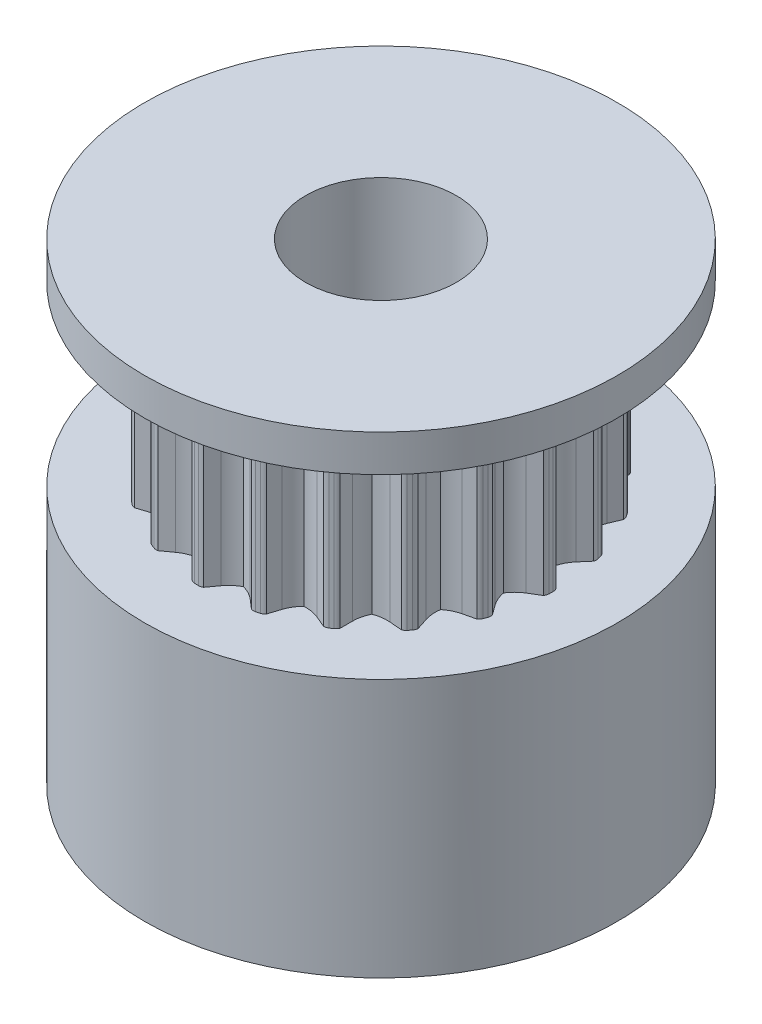
from build123d import *

# Parameters (mm, degrees)
EXTRUDE_1_DEPTH     = 3
SKETCH_3_R          = 8
EXTRUDE_2_DEPTH     = 1.25
SKETCH_4_R          = 2.55
CUT_EXTRUDE_1_DEPTH = 15.150971698
SKETCH_6_W          = 5.5
SKETCH_6_H          = 7.5


with BuildPart() as part:
    # 草图1 → 凸台-拉伸1 (new, symmetric)
    with BuildSketch(Plane(origin=(0, 0, 0), x_dir=(1, 0, 0), z_dir=(0, 1, 0))):
        with BuildLine():
            Line((-3.376752543, 4.959590937), (-3.267426565, 5.032288112))
            ThreePointArc((-3.267426565, 5.032288112), (-3.200992642, 5.061911558), (-3.128917634, 5.071720118))
            Line((-3.128917634, 5.071720118), (-2.741254989, 4.909115673))
            ThreePointArc((-2.741254989, 4.909115673), (-2.480001123, 4.833197231), (-2.208338066, 4.818487533))
            ThreePointArc((-2.208338066, 4.818487533), (-2.042130114, 5.033875807), (-1.929083368, 5.281338179))
            Line((-1.929083368, 5.281338179), (-1.799177632, 5.681146923))
            ThreePointArc((-1.799177632, 5.681146923), (-1.744694694, 5.729340533), (-1.678884625, 5.7603252))
            Line((-1.678884625, 5.7603252), (-1.552444779, 5.795680737))
            ThreePointArc((-1.552444779, 5.795680737), (-1.480108215, 5.803325098), (-1.408529797, 5.79038119))
            Line((-1.408529797, 5.79038119), (-1.09008825, 5.515940827))
            ThreePointArc((-1.09008825, 5.515940827), (-0.865081147, 5.363006214), (-0.611259773, 5.265067959))
            ThreePointArc((-0.611259773, 5.265067959), (-0.38662798, 5.418553299), (-0.202644057, 5.618970634))
            Line((-0.202644057, 5.618970634), (0.044451336, 5.959068265))
            ThreePointArc((0.044451336, 5.959068265), (0.111160334, 5.988066959), (0.183324217, 5.997198699))
            Line((0.183324217, 5.997198699), (0.314501119, 5.991751751))
            ThreePointArc((0.314501119, 5.991751751), (0.385659516, 5.976668742), (0.449734749, 5.942239407))
            Line((0.449734749, 5.942239407), (0.667783922, 5.582827262))
            ThreePointArc((0.667783922, 5.582827262), (0.834518999, 5.367846783), (1.045652886, 5.196266848))
            ThreePointArc((1.045652886, 5.196266848), (1.306719995, 5.27282504), (1.543631466, 5.406579094))
            Line((1.543631466, 5.406579094), (1.883729097, 5.653674487))
            ThreePointArc((1.883729097, 5.653674487), (1.956134214, 5.660639669), (2.027588008, 5.647024603))
            Line((2.027588008, 5.647024603), (2.150661455, 5.601308356))
            ThreePointArc((2.150661455, 5.601308356), (2.213676207, 5.564974409), (2.263976125, 5.512429829))
            Line((2.263976125, 5.512429829), (2.360288751, 5.103227666))
            ThreePointArc((2.360288751, 5.103227666), (2.452430611, 4.847245108), (2.600209754, 4.618818935))
            ThreePointArc((2.600209754, 4.618818935), (2.872157112, 4.610955928), (3.138805586, 4.664953922))
            Line((3.138805586, 4.664953922), (3.53861433, 4.794859658))
            ThreePointArc((3.53861433, 4.794859658), (3.609628047, 4.779109528), (3.673377357, 4.744080395))
            Line((3.673377357, 4.744080395), (3.776300064, 4.662569873))
            ThreePointArc((3.776300064, 4.662569873), (3.825002847, 4.608541606), (3.856603744, 4.543025212))
            Line((3.856603744, 4.543025212), (3.821752072, 4.12408859))
            ThreePointArc((3.821752072, 4.12408859), (3.830281228, 3.85216131), (3.900239975, 3.589248842))
            ThreePointArc((3.900239975, 3.589248842), (4.156447479, 3.497734324), (4.426731546, 3.466690558))
            Line((4.426731546, 3.466690558), (4.847115337, 3.466690558))
            ThreePointArc((4.847115337, 3.466690558), (4.909786338, 3.429766849), (4.959590937, 3.376752543))
            Line((4.959590937, 3.376752543), (5.032288112, 3.267426565))
            ThreePointArc((5.032288112, 3.267426565), (5.061911558, 3.200992642), (5.071720118, 3.128917634))
            Line((5.071720118, 3.128917634), (4.909115673, 2.741254989))
            ThreePointArc((4.909115673, 2.741254989), (4.833197231, 2.480001123), (4.818487533, 2.208338066))
            ThreePointArc((4.818487533, 2.208338066), (5.033875807, 2.042130114), (5.281338179, 1.929083368))
            Line((5.281338179, 1.929083368), (5.681146923, 1.799177632))
            ThreePointArc((5.681146923, 1.799177632), (5.729340533, 1.744694694), (5.7603252, 1.678884625))
            Line((5.7603252, 1.678884625), (5.795680737, 1.552444779))
            ThreePointArc((5.795680737, 1.552444779), (5.803325098, 1.480108215), (5.79038119, 1.408529797))
            Line((5.79038119, 1.408529797), (5.515940827, 1.09008825))
            ThreePointArc((5.515940827, 1.09008825), (5.363006214, 0.865081147), (5.265067959, 0.611259773))
            ThreePointArc((5.265067959, 0.611259773), (5.418553299, 0.38662798), (5.618970634, 0.202644057))
            Line((5.618970634, 0.202644057), (5.959068265, -0.044451336))
            ThreePointArc((5.959068265, -0.044451336), (5.988066959, -0.111160334), (5.997198699, -0.183324217))
            Line((5.997198699, -0.183324217), (5.991751751, -0.314501119))
            ThreePointArc((5.991751751, -0.314501119), (5.976668742, -0.385659516), (5.942239407, -0.449734749))
            Line((5.942239407, -0.449734749), (5.582827262, -0.667783922))
            ThreePointArc((5.582827262, -0.667783922), (5.367846783, -0.834518999), (5.196266848, -1.045652886))
            ThreePointArc((5.196266848, -1.045652886), (5.27282504, -1.306719995), (5.406579094, -1.543631466))
            Line((5.406579094, -1.543631466), (5.653674487, -1.883729097))
            ThreePointArc((5.653674487, -1.883729097), (5.660639669, -1.956134214), (5.647024603, -2.027588008))
            Line((5.647024603, -2.027588008), (5.601308356, -2.150661455))
            ThreePointArc((5.601308356, -2.150661455), (5.564974409, -2.213676207), (5.512429829, -2.263976125))
            Line((5.512429829, -2.263976125), (5.103227666, -2.360288751))
            ThreePointArc((5.103227666, -2.360288751), (4.847245108, -2.452430611), (4.618818935, -2.600209754))
            ThreePointArc((4.618818935, -2.600209754), (4.610955928, -2.872157112), (4.664953922, -3.138805586))
            Line((4.664953922, -3.138805586), (4.794859658, -3.53861433))
            ThreePointArc((4.794859658, -3.53861433), (4.779109528, -3.609628047), (4.744080395, -3.673377357))
            Line((4.744080395, -3.673377357), (4.662569873, -3.776300064))
            ThreePointArc((4.662569873, -3.776300064), (4.608541606, -3.825002847), (4.543025212, -3.856603744))
            Line((4.543025212, -3.856603744), (4.12408859, -3.821752072))
            ThreePointArc((4.12408859, -3.821752072), (3.85216131, -3.830281228), (3.589248842, -3.900239975))
            ThreePointArc((3.589248842, -3.900239975), (3.497734324, -4.156447479), (3.466690558, -4.426731546))
            Line((3.466690558, -4.426731546), (3.466690558, -4.847115337))
            ThreePointArc((3.466690558, -4.847115337), (3.429766849, -4.909786338), (3.376752543, -4.959590937))
            Line((3.376752543, -4.959590937), (3.267426565, -5.032288112))
            ThreePointArc((3.267426565, -5.032288112), (3.200992642, -5.061911558), (3.128917634, -5.071720118))
            Line((3.128917634, -5.071720118), (2.741254989, -4.909115673))
            ThreePointArc((2.741254989, -4.909115673), (2.480001123, -4.833197231), (2.208338066, -4.818487533))
            ThreePointArc((2.208338066, -4.818487533), (2.042130114, -5.033875807), (1.929083368, -5.281338179))
            Line((1.929083368, -5.281338179), (1.799177632, -5.681146923))
            ThreePointArc((1.799177632, -5.681146923), (1.744694694, -5.729340533), (1.678884625, -5.7603252))
            Line((1.678884625, -5.7603252), (1.552444779, -5.795680737))
            ThreePointArc((1.552444779, -5.795680737), (1.480108215, -5.803325098), (1.408529797, -5.79038119))
            Line((1.408529797, -5.79038119), (1.09008825, -5.515940827))
            ThreePointArc((1.09008825, -5.515940827), (0.865081147, -5.363006214), (0.611259773, -5.265067959))
            ThreePointArc((0.611259773, -5.265067959), (0.38662798, -5.418553299), (0.202644057, -5.618970634))
            Line((0.202644057, -5.618970634), (-0.044451336, -5.959068265))
            ThreePointArc((-0.044451336, -5.959068265), (-0.111160334, -5.988066959), (-0.183324217, -5.997198699))
            Line((-0.183324217, -5.997198699), (-0.314501119, -5.991751751))
            ThreePointArc((-0.314501119, -5.991751751), (-0.385659516, -5.976668742), (-0.449734749, -5.942239407))
            Line((-0.449734749, -5.942239407), (-0.667783922, -5.582827262))
            ThreePointArc((-0.667783922, -5.582827262), (-0.834518999, -5.367846783), (-1.045652886, -5.196266848))
            ThreePointArc((-1.045652886, -5.196266848), (-1.306719995, -5.27282504), (-1.543631466, -5.406579094))
            Line((-1.543631466, -5.406579094), (-1.883729097, -5.653674487))
            ThreePointArc((-1.883729097, -5.653674487), (-1.956134214, -5.660639669), (-2.027588008, -5.647024603))
            Line((-2.027588008, -5.647024603), (-2.150661455, -5.601308356))
            ThreePointArc((-2.150661455, -5.601308356), (-2.213676207, -5.564974409), (-2.263976125, -5.512429829))
            Line((-2.263976125, -5.512429829), (-2.360288751, -5.103227666))
            ThreePointArc((-2.360288751, -5.103227666), (-2.452430611, -4.847245108), (-2.600209754, -4.618818935))
            ThreePointArc((-2.600209754, -4.618818935), (-2.872157112, -4.610955928), (-3.138805586, -4.664953922))
            Line((-3.138805586, -4.664953922), (-3.53861433, -4.794859658))
            ThreePointArc((-3.53861433, -4.794859658), (-3.609628047, -4.779109528), (-3.673377357, -4.744080395))
            Line((-3.673377357, -4.744080395), (-3.776300064, -4.662569873))
            ThreePointArc((-3.776300064, -4.662569873), (-3.825002847, -4.608541606), (-3.856603744, -4.543025212))
            Line((-3.856603744, -4.543025212), (-3.821752072, -4.12408859))
            ThreePointArc((-3.821752072, -4.12408859), (-3.830281228, -3.85216131), (-3.900239975, -3.589248842))
            ThreePointArc((-3.900239975, -3.589248842), (-4.156447479, -3.497734324), (-4.426731546, -3.466690558))
            Line((-4.426731546, -3.466690558), (-4.847115337, -3.466690558))
            ThreePointArc((-4.847115337, -3.466690558), (-4.909786338, -3.429766849), (-4.959590937, -3.376752543))
            Line((-4.959590937, -3.376752543), (-5.032288112, -3.267426565))
            ThreePointArc((-5.032288112, -3.267426565), (-5.061911558, -3.200992642), (-5.071720118, -3.128917634))
            Line((-5.071720118, -3.128917634), (-4.909115673, -2.741254989))
            ThreePointArc((-4.909115673, -2.741254989), (-4.833197231, -2.480001123), (-4.818487533, -2.208338066))
            ThreePointArc((-4.818487533, -2.208338066), (-5.033875807, -2.042130114), (-5.281338179, -1.929083368))
            Line((-5.281338179, -1.929083368), (-5.681146923, -1.799177632))
            ThreePointArc((-5.681146923, -1.799177632), (-5.729340533, -1.744694694), (-5.7603252, -1.678884625))
            Line((-5.7603252, -1.678884625), (-5.795680737, -1.552444779))
            ThreePointArc((-5.795680737, -1.552444779), (-5.803325098, -1.480108215), (-5.79038119, -1.408529797))
            Line((-5.79038119, -1.408529797), (-5.515940827, -1.09008825))
            ThreePointArc((-5.515940827, -1.09008825), (-5.363006214, -0.865081147), (-5.265067959, -0.611259773))
            ThreePointArc((-5.265067959, -0.611259773), (-5.418553299, -0.38662798), (-5.618970634, -0.202644057))
            Line((-5.618970634, -0.202644057), (-5.959068265, 0.044451336))
            ThreePointArc((-5.959068265, 0.044451336), (-5.988066959, 0.111160334), (-5.997198699, 0.183324217))
            Line((-5.997198699, 0.183324217), (-5.991751751, 0.314501119))
            ThreePointArc((-5.991751751, 0.314501119), (-5.976668742, 0.385659516), (-5.942239407, 0.449734749))
            Line((-5.942239407, 0.449734749), (-5.582827262, 0.667783922))
            ThreePointArc((-5.582827262, 0.667783922), (-5.367846783, 0.834518999), (-5.196266848, 1.045652886))
            ThreePointArc((-5.196266848, 1.045652886), (-5.27282504, 1.306719995), (-5.406579094, 1.543631466))
            Line((-5.406579094, 1.543631466), (-5.653674487, 1.883729097))
            ThreePointArc((-5.653674487, 1.883729097), (-5.660639669, 1.956134214), (-5.647024603, 2.027588008))
            Line((-5.647024603, 2.027588008), (-5.601308356, 2.150661455))
            ThreePointArc((-5.601308356, 2.150661455), (-5.564974409, 2.213676207), (-5.512429829, 2.263976125))
            Line((-5.512429829, 2.263976125), (-5.103227666, 2.360288751))
            ThreePointArc((-5.103227666, 2.360288751), (-4.847245108, 2.452430611), (-4.618818935, 2.600209754))
            ThreePointArc((-4.618818935, 2.600209754), (-4.610955928, 2.872157112), (-4.664953922, 3.138805586))
            Line((-4.664953922, 3.138805586), (-4.794859658, 3.53861433))
            ThreePointArc((-4.794859658, 3.53861433), (-4.779109528, 3.609628047), (-4.744080395, 3.673377357))
            Line((-4.744080395, 3.673377357), (-4.662569873, 3.776300064))
            ThreePointArc((-4.662569873, 3.776300064), (-4.608541606, 3.825002847), (-4.543025212, 3.856603744))
            Line((-4.543025212, 3.856603744), (-4.12408859, 3.821752072))
            ThreePointArc((-4.12408859, 3.821752072), (-3.85216131, 3.830281228), (-3.589248842, 3.900239975))
            ThreePointArc((-3.589248842, 3.900239975), (-3.497734324, 4.156447479), (-3.466690558, 4.426731546))
            Line((-3.466690558, 4.426731546), (-3.466690558, 4.847115337))
            ThreePointArc((-3.466690558, 4.847115337), (-3.429766849, 4.909786338), (-3.376752543, 4.959590937))
        make_face()
    extrude(amount=EXTRUDE_1_DEPTH, both=True)

    # 草图3 → 凸台-拉伸2 (add)
    with BuildSketch(Plane(origin=(0, 3, 0), x_dir=(1, 0, 0), z_dir=(0, 1, 0))):
        with Locations(Location((0, 0, 0), (0, 0, 270))):
            Circle(SKETCH_3_R)
    extrude_2 = extrude(amount=EXTRUDE_2_DEPTH)

    # 镜向1: 凸台-拉伸2 across plane
    add(extrude_2.mirror(Plane.ZX))

    # 草图4 → 切除-拉伸1 (cut, through all)
    with BuildSketch(Plane(origin=(0, 4.25, 0), x_dir=(1, 0, 0), z_dir=(0, 1, 0))):
        with Locations(Location((0, 0, 0), (0, 0, 270))):
            Circle(SKETCH_4_R)
    extrude(amount=-CUT_EXTRUDE_1_DEPTH, mode=Mode.SUBTRACT)

    # 草图6 → 旋转1 (revolve)
    with BuildSketch(Plane.XY, mode=Mode.PRIVATE) as revolve_1_sk:
        with Locations((-5.25, -8)):
            Rectangle(SKETCH_6_W, SKETCH_6_H)
    revolve(revolve_1_sk.sketch.rotate(Axis((0, -11.75, 0), (0, 1, 0)), 90), axis=Axis((0, -11.75, 0), (0, 1, 0)))


solid = part.part
